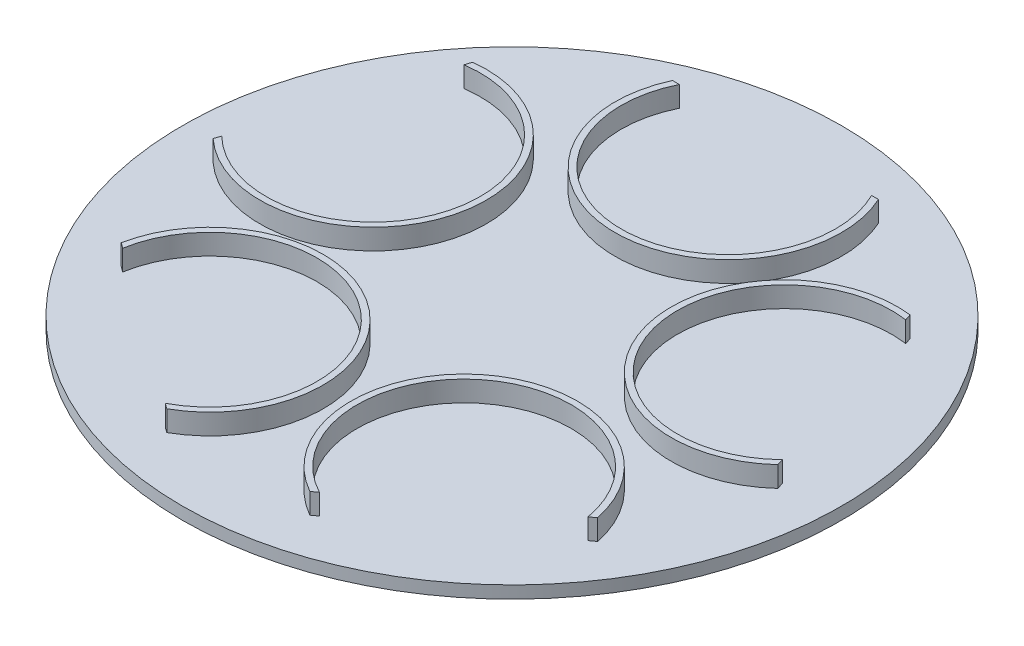
from build123d import *

# Parameters (mm, degrees)
SKETCH_1_R      = 80
EXTRUDE_1_DEPTH = 3
EXTRUDE_2_DEPTH = 8


with BuildPart() as part:
    # 草图1 → 凸台-拉伸1 (new body)
    with BuildSketch(Plane(origin=(0, 0, 0), x_dir=(1, 0, 0), z_dir=(0, 1, 0))):
        Circle(SKETCH_1_R)
        with BuildLine():
            ThreePointArc((-23.339880034, 63.956439237), (0, 26.5), (23.339880034, 63.956439237))
            Line((23.339880034, 63.956439237), (25, 63.956439237))
            ThreePointArc((25, 63.956439237), (0, 25), (-25, 63.956439237))
            Line((-25, 63.956439237), (-23.339880034, 63.956439237))
        make_face(mode=Mode.SUBTRACT)
        with BuildLine():
            ThreePointArc((-18.710292179, -65.460683517), (-15.576309186, -21.438950351), (-56.475011367, -38.023008969))
            Line((-56.475011367, -38.023008969), (-57.818076632, -37.047214935))
            ThreePointArc((-57.818076632, -37.047214935), (-14.694631307, -20.225424859), (-17.367226914, -66.43647755))
            Line((-17.367226914, -66.43647755), (-18.710292179, -65.460683517))
        make_face(mode=Mode.SUBTRACT)
        with BuildLine():
            ThreePointArc((-68.038607873, -2.433918372), (-25.202997682, 8.188950351), (-53.613768719, 41.96117162))
            Line((-53.613768719, 41.96117162), (-53.100763436, 43.540039531))
            ThreePointArc((-53.100763436, 43.540039531), (-23.776412907, 7.725424859), (-68.551613155, -4.012786283))
            Line((-68.551613155, -4.012786283), (-68.038607873, -2.433918372))
        make_face(mode=Mode.SUBTRACT)
        with BuildLine():
            ThreePointArc((68.551613155, -4.012786283), (23.776412907, 7.725424859), (53.100763436, 43.540039531))
            Line((53.100763436, 43.540039531), (53.613768719, 41.96117162))
            ThreePointArc((53.613768719, 41.96117162), (25.202997682, 8.188950351), (68.038607873, -2.433918372))
            Line((68.038607873, -2.433918372), (68.551613155, -4.012786283))
        make_face(mode=Mode.SUBTRACT)
        with BuildLine():
            ThreePointArc((56.475011367, -38.023008969), (15.576309186, -21.438950351), (18.710292179, -65.460683517))
            Line((18.710292179, -65.460683517), (17.367226914, -66.43647755))
            ThreePointArc((17.367226914, -66.43647755), (14.694631307, -20.225424859), (57.818076632, -37.047214935))
            Line((57.818076632, -37.047214935), (56.475011367, -38.023008969))
        make_face(mode=Mode.SUBTRACT)
    extrude(amount=EXTRUDE_1_DEPTH)

    # 草图1<5> → 凸台-拉伸2 (add)
    with BuildSketch(Plane(origin=(0, 0, 0), x_dir=(1, 0, 0), z_dir=(0, 1, 0))):
        with BuildLine():
            Line((-25, 63.956439237), (-23.339880034, 63.956439237))
            ThreePointArc((-23.339880034, 63.956439237), (0, 26.5), (23.339880034, 63.956439237))
            Line((23.339880034, 63.956439237), (25, 63.956439237))
            ThreePointArc((25, 63.956439237), (0, 25), (-25, 63.956439237))
        make_face()
        with BuildLine():
            Line((68.038607873, -2.433918372), (68.551613155, -4.012786283))
            ThreePointArc((68.551613155, -4.012786283), (23.776412907, 7.725424859), (53.100763436, 43.540039531))
            Line((53.100763436, 43.540039531), (53.613768719, 41.96117162))
            ThreePointArc((53.613768719, 41.96117162), (25.202997682, 8.188950351), (68.038607873, -2.433918372))
        make_face()
        with BuildLine():
            Line((18.710292179, -65.460683517), (17.367226914, -66.43647755))
            ThreePointArc((17.367226914, -66.43647755), (14.694631307, -20.225424859), (57.818076632, -37.047214935))
            Line((57.818076632, -37.047214935), (56.475011367, -38.023008969))
            ThreePointArc((56.475011367, -38.023008969), (15.576309186, -21.438950351), (18.710292179, -65.460683517))
        make_face()
        with BuildLine():
            Line((-56.475011367, -38.023008969), (-57.818076632, -37.047214935))
            ThreePointArc((-57.818076632, -37.047214935), (-14.694631307, -20.225424859), (-17.367226914, -66.43647755))
            Line((-17.367226914, -66.43647755), (-18.710292179, -65.460683517))
            ThreePointArc((-18.710292179, -65.460683517), (-15.576309186, -21.438950351), (-56.475011367, -38.023008969))
        make_face()
        with BuildLine():
            Line((-53.613768719, 41.96117162), (-53.100763436, 43.540039531))
            ThreePointArc((-53.100763436, 43.540039531), (-23.776412907, 7.725424859), (-68.551613155, -4.012786283))
            Line((-68.551613155, -4.012786283), (-68.038607873, -2.433918372))
            ThreePointArc((-68.038607873, -2.433918372), (-25.202997682, 8.188950351), (-53.613768719, 41.96117162))
        make_face()
    extrude(amount=EXTRUDE_2_DEPTH)


solid = part.part
